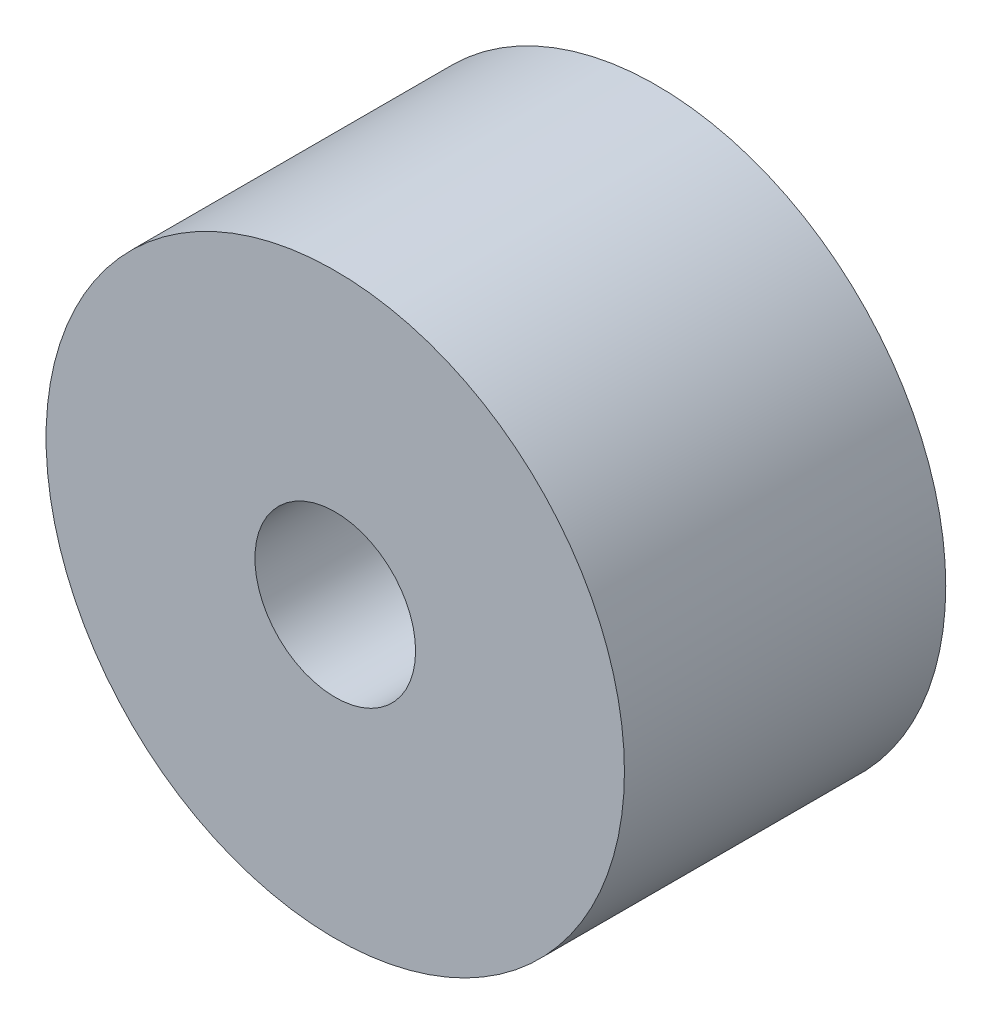
from build123d import *

# Parameters (mm, degrees)
SKETCH1_R           = 18
BOSS_EXTRUDE1_DEPTH = 20
SKETCH2_R           = 5
CUT_EXTRUDE1_DEPTH  = 20


with BuildPart() as part:
    # Sketch1 → Boss-Extrude1 (new body)
    with BuildSketch(Plane.XY):
        Circle(SKETCH1_R)
    extrude(amount=BOSS_EXTRUDE1_DEPTH)

    # Sketch2 → Cut-Extrude1 (cut)
    with BuildSketch(Plane.XY):
        Circle(SKETCH2_R)
    extrude(amount=CUT_EXTRUDE1_DEPTH, mode=Mode.SUBTRACT)


solid = part.part
